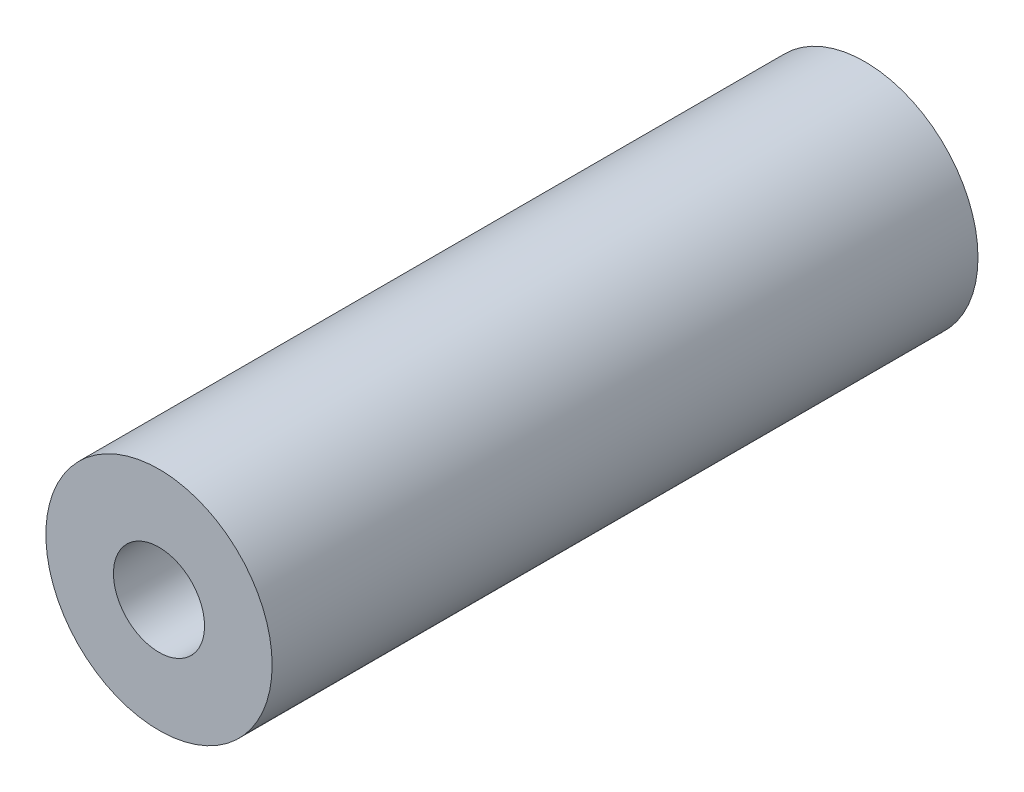
from build123d import *

# Parameters (mm, degrees)
SKETCH1_R           = 31.55315
SKETCH1_R_2         = 12.7
BOSS_EXTRUDE1_DEPTH = 196.85


with BuildPart() as part:
    # Sketch1 → Boss-Extrude1 (new body)
    with BuildSketch(Plane.XY):
        Circle(SKETCH1_R)
        Circle(SKETCH1_R_2, mode=Mode.SUBTRACT)
    extrude(amount=BOSS_EXTRUDE1_DEPTH)


solid = part.part
